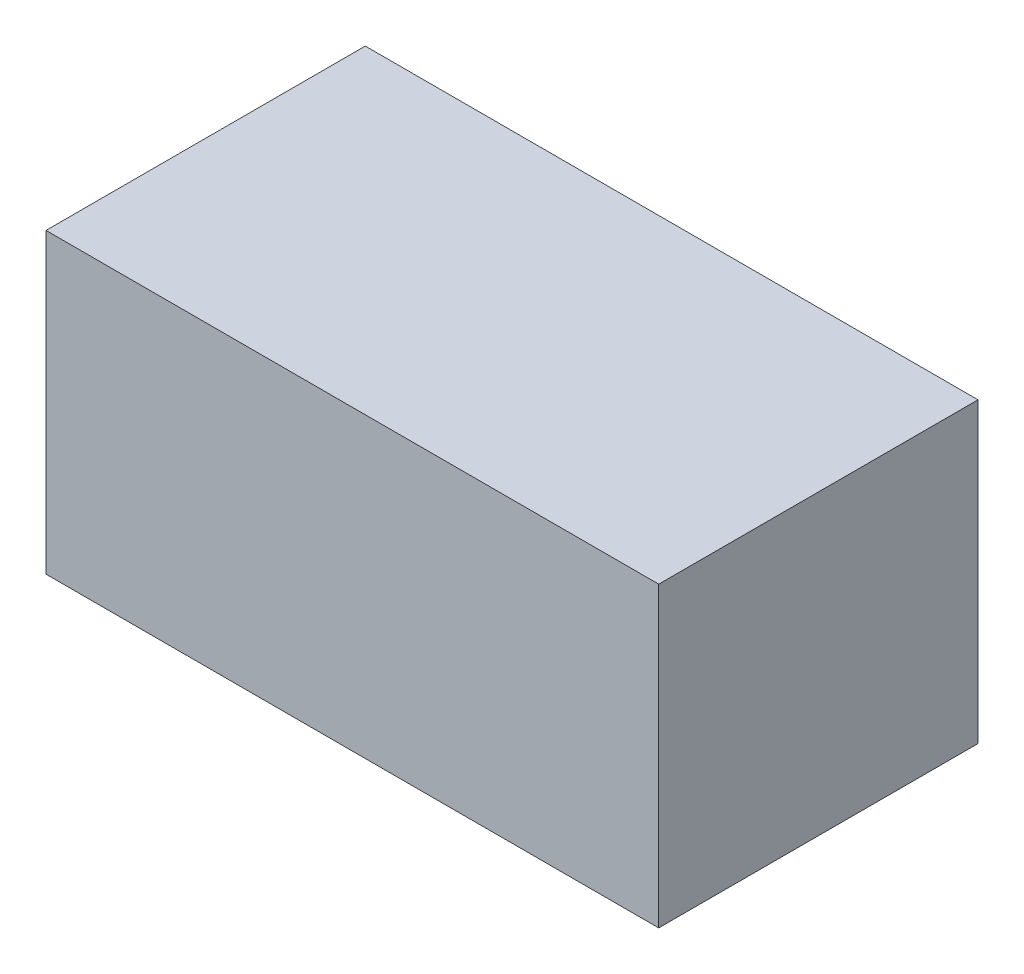
from build123d import *

# Parameters (mm, degrees)
SKETCH_1_W      = 71
SKETCH_1_H      = 37
EXTRUDE_1_DEPTH = 34.5


with BuildPart() as part:
    # 草图1 → 凸台-拉伸1 (new body)
    with BuildSketch(Plane(origin=(0, 0, 0), x_dir=(1, 0, 0), z_dir=(0, 1, 0))):
        Rectangle(SKETCH_1_W, SKETCH_1_H)
    extrude(amount=EXTRUDE_1_DEPTH)


solid = part.part
